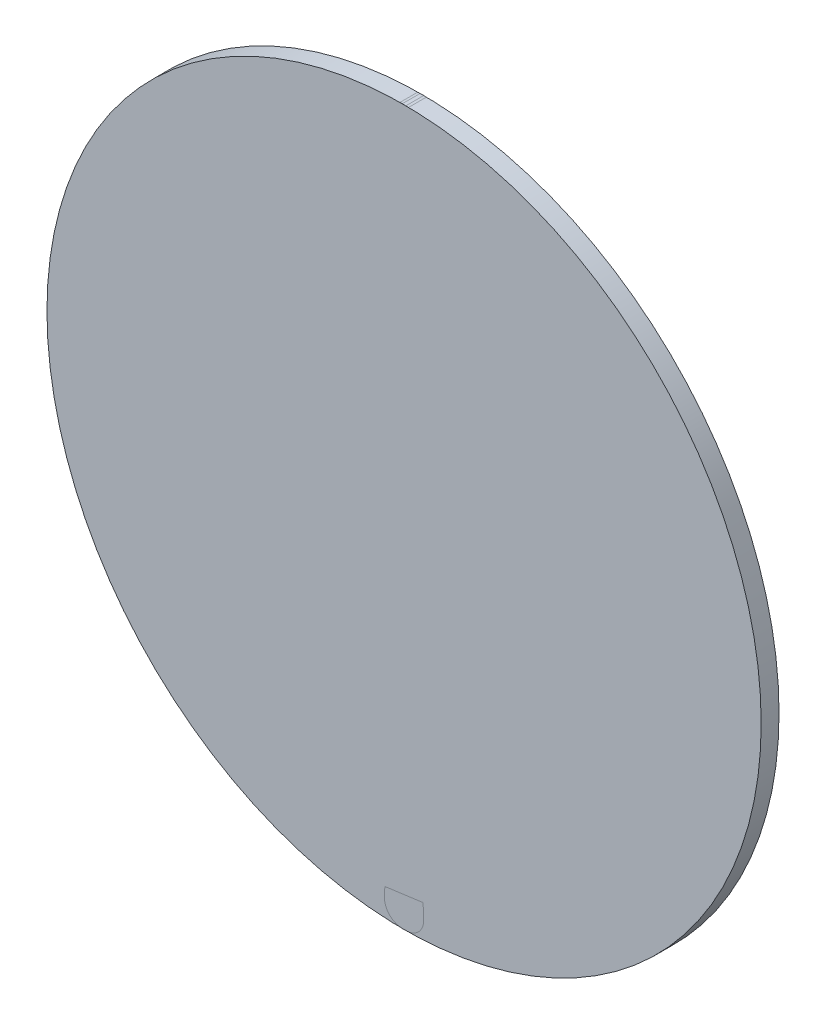
from build123d import *

# Parameters (mm, degrees)
SKETCH1_R           = 2.54
BOSS_EXTRUDE1_DEPTH = 3.175
SKETCH2_R           = 127.001617852
BOSS_EXTRUDE2_DEPTH = 6.35


with BuildPart() as part:
    # Sketch1 → Boss-Extrude1 (new, symmetric)
    with BuildSketch(Plane(origin=(0, 0, 0), x_dir=(0, 1, 0), z_dir=(0, 0, 1))):
        with BuildLine():
            Line((-9.282710437, 2.134692472), (-120.37301689, 6.985))
            ThreePointArc((-120.37301689, 6.985), (-125.041107904, 5.228054952), (-127, 0.641043793))
            Line((-127, 0.641043793), (-127, -0.641043793))
            ThreePointArc((-127, -0.641043793), (-125.041107904, -5.228054952), (-120.37301689, -6.985))
            Line((-120.37301689, -6.985), (-9.282710437, -2.134692472))
            ThreePointArc((-9.282710437, -2.134692472), (0, -9.525), (9.282710437, -2.134692472))
            Line((9.282710437, -2.134692472), (120.37301689, -6.985))
            ThreePointArc((120.37301689, -6.985), (125.041107904, -5.228054952), (127, -0.641043793))
            Line((127, -0.641043793), (127, 0.641043793))
            ThreePointArc((127, 0.641043793), (125.041107904, 5.228054952), (120.37301689, 6.985))
            Line((120.37301689, 6.985), (9.282710437, 2.134692472))
            ThreePointArc((9.282710437, 2.134692472), (0, 9.525), (-9.282710437, 2.134692472))
        make_face()
        with Locations(Location((0, 0, 0), (0, 0, 270))):
            Circle(SKETCH1_R, mode=Mode.SUBTRACT)
    extrude(amount=BOSS_EXTRUDE1_DEPTH, both=True)


with BuildPart() as body_2:
    # Sketch2 → Boss-Extrude2 (new body)
    with BuildSketch(Plane.XY.offset(3.175)):
        Circle(SKETCH2_R)
    extrude(amount=-BOSS_EXTRUDE2_DEPTH)


solid = Compound([part.part, body_2.part])
